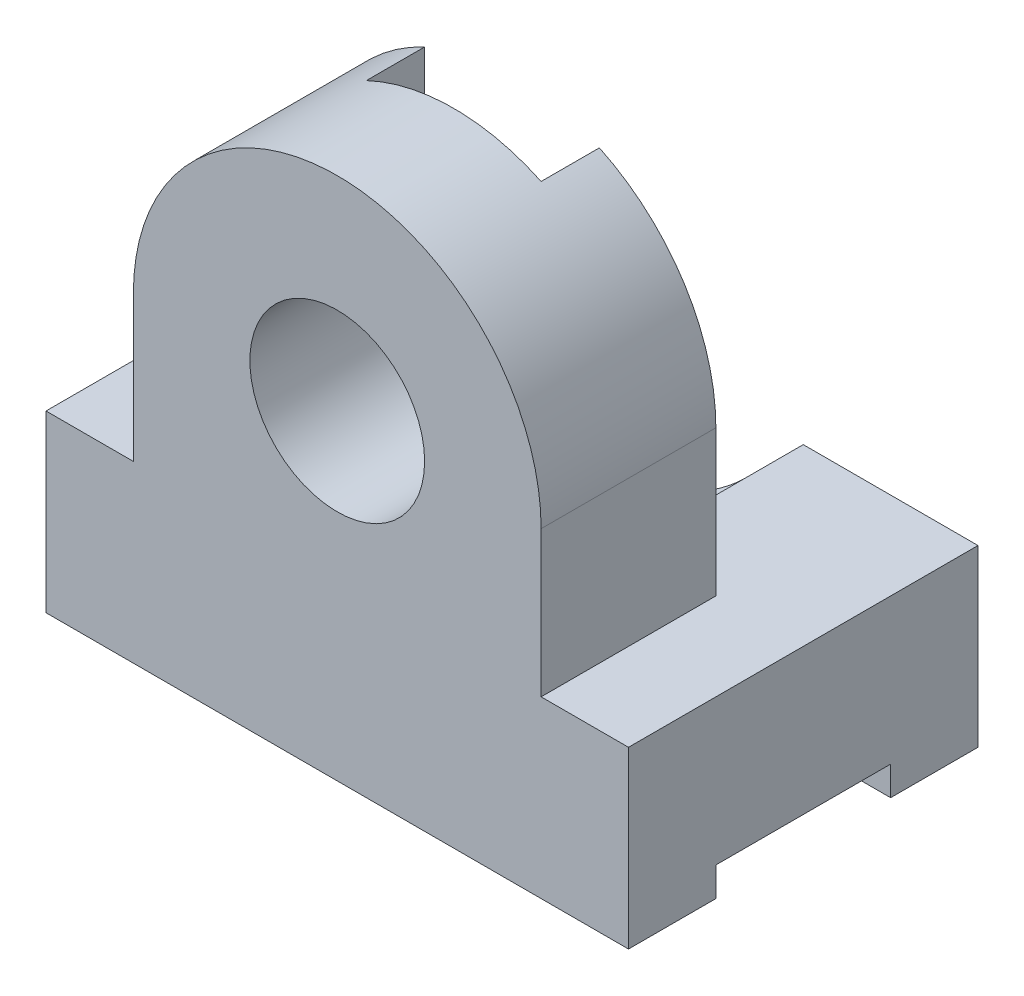
from build123d import *

# Parameters (mm, degrees)
SKETCH1_W           = 100
SKETCH1_H           = 30
BOSS_EXTRUDE1_DEPTH = 60
SKETCH1_3_R         = 15
BOSS_EXTRUDE2_DEPTH = 30
CUT_EXTRUDE1_START  = -40
SKETCH1_4_W         = 40
SKETCH1_4_H         = 10
CUT_EXTRUDE1_DEPTH  = 69.282039139
SKETCH2_W           = 30
SKETCH2_H           = 10
CUT_EXTRUDE2_DEPTH  = 139.654246239
CUT_EXTRUDE3_START  = -10
CUT_EXTRUDE3_DEPTH  = 10
SKETCH4_R           = 10
CUT_EXTRUDE4_DEPTH  = 105.880884817


with BuildPart() as part:
    # Sketch1 → Boss-Extrude1 (new body)
    with BuildSketch(Plane.XY):
        Rectangle(SKETCH1_W, SKETCH1_H)
    extrude(amount=-BOSS_EXTRUDE1_DEPTH)

    # Sketch1<3> → Boss-Extrude2 (add)
    with BuildSketch(Plane.XY):
        with BuildLine():
            Line((-35, 40), (-35, 15))
            Line((-35, 15), (-20, 15))
            Line((-20, 15), (20, 15))
            Line((20, 15), (35, 15))
            Line((35, 15), (35, 40))
            ThreePointArc((35, 40), (0, 75), (-35, 40))
        make_face()
        with Locations((0, 40)):
            Circle(SKETCH1_3_R, mode=Mode.SUBTRACT)
    extrude(amount=-BOSS_EXTRUDE2_DEPTH)

    # Sketch1<4> → Cut-Extrude1 (cut, through all)
    with BuildSketch(Plane.XY.offset(CUT_EXTRUDE1_START)):
        with Locations((0, 10)):
            Rectangle(SKETCH1_4_W, SKETCH1_4_H)
    extrude(amount=-CUT_EXTRUDE1_DEPTH, mode=Mode.SUBTRACT)

    # Sketch2 → Cut-Extrude2 (cut, through all)
    with BuildSketch(Plane(origin=(50, 0, 0), x_dir=(0, 0, -1), z_dir=(1, 0, 0))):
        with Locations((30, -15)):
            Rectangle(SKETCH2_W, SKETCH2_H)
    extrude(amount=-CUT_EXTRUDE2_DEPTH, mode=Mode.SUBTRACT)

    # Sketch3 → Cut-Extrude3 (cut)
    with BuildSketch(Plane(origin=(0, 0, -30), x_dir=(-1, 0, 0), z_dir=(0, 0, -1)).offset(CUT_EXTRUDE3_START)):
        with BuildLine():
            Line((15, 40), (15, 85.033892836))
            Line((15, 85.033892836), (-15, 85.033892836))
            Line((-15, 85.033892836), (-15, 40))
            ThreePointArc((-15, 40), (0, 25), (15, 40))
        make_face()
    extrude(amount=CUT_EXTRUDE3_DEPTH, mode=Mode.SUBTRACT)

    # Sketch4 → Cut-Extrude4 (cut, through all)
    with BuildSketch(Plane(origin=(0, 5, 0), x_dir=(1, 0, 0), z_dir=(0, 1, 0))):
        with Locations((0, 60)):
            Circle(SKETCH4_R)
    extrude(amount=-CUT_EXTRUDE4_DEPTH, mode=Mode.SUBTRACT)


solid = part.part
